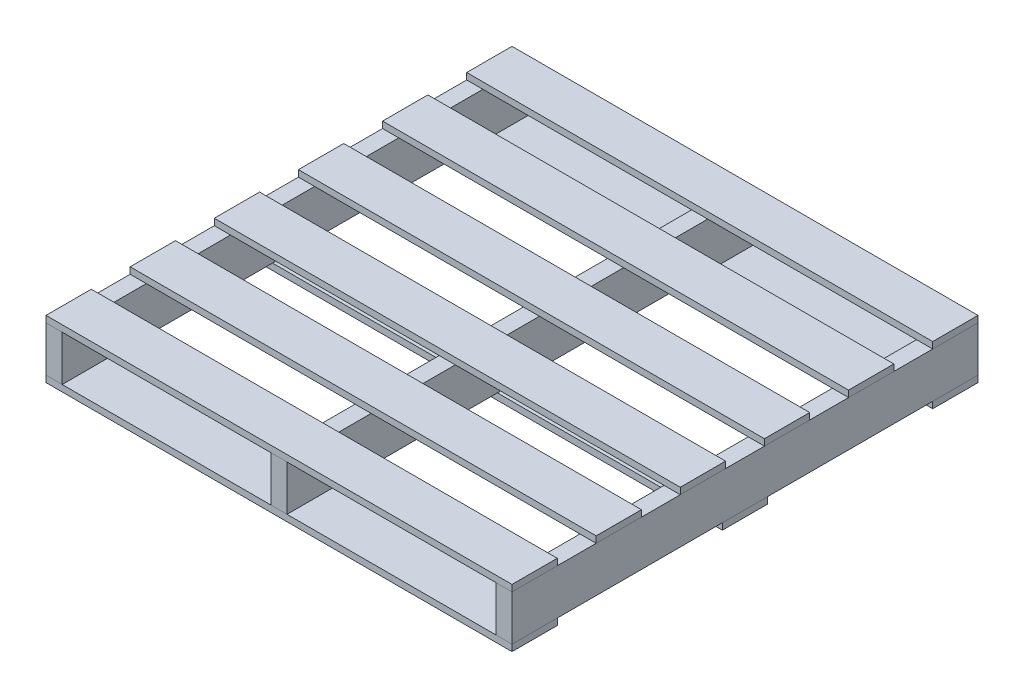
from build123d import *

# Parameters (mm, degrees)
BOSS_EXTRUDE1_DEPTH        = 457.2
BOSS_EXTRUDE1_DEPTH_BACK   = 457.2
SKETCH3_W                  = 31.75
SKETCH3_H                  = 88.9
BOSS_EXTRUDE1_2_DEPTH      = 457.2
BOSS_EXTRUDE1_2_DEPTH_BACK = 457.2
SKETCH3_W_2                = 31.496
BOSS_EXTRUDE1_3_DEPTH      = 457.2
BOSS_EXTRUDE1_3_DEPTH_BACK = 457.2
SKETCH4_W                  = 914.4
SKETCH4_H                  = 88.9
BOSS_EXTRUDE2_DEPTH        = 12.7
BOSS_EXTRUDE2_2_DEPTH      = 12.7
BOSS_EXTRUDE2_3_DEPTH      = 12.7
BOSS_EXTRUDE2_4_DEPTH      = 12.7
BOSS_EXTRUDE2_5_DEPTH      = 12.7
BOSS_EXTRUDE2_6_DEPTH      = 12.7
SKETCH5_W                  = 914.4
SKETCH5_H                  = 88.9
BOSS_EXTRUDE3_DEPTH        = 12.7
BOSS_EXTRUDE3_2_DEPTH      = 12.7
BOSS_EXTRUDE3_3_DEPTH      = 12.7


with BuildPart() as part:
    # Sketch3 → Boss-Extrude1 (new, two sides: drawn at the far end of the back side and taken through both)
    with BuildSketch(Plane.XY.offset(-BOSS_EXTRUDE1_DEPTH_BACK)):
        with Locations((-441.325, 0)):
            Rectangle(SKETCH3_W, SKETCH3_H)
    extrude(amount=BOSS_EXTRUDE1_DEPTH + BOSS_EXTRUDE1_DEPTH_BACK)


with BuildPart() as body_2:
    # Sketch3 → Boss-Extrude1 2 (new, two sides: drawn at the far end of the back side and taken through both)
    with BuildSketch(Plane.XY.offset(-BOSS_EXTRUDE1_2_DEPTH_BACK)):
        Rectangle(SKETCH3_W_2, SKETCH3_H)
    extrude(amount=BOSS_EXTRUDE1_2_DEPTH + BOSS_EXTRUDE1_2_DEPTH_BACK)


with BuildPart() as body_3:
    # Sketch3 → Boss-Extrude1 3 (new, two sides: drawn at the far end of the back side and taken through both)
    with BuildSketch(Plane.XY.offset(-BOSS_EXTRUDE1_3_DEPTH_BACK)):
        with Locations((441.325, 0)):
            Rectangle(SKETCH3_W, SKETCH3_H)
    extrude(amount=BOSS_EXTRUDE1_3_DEPTH + BOSS_EXTRUDE1_3_DEPTH_BACK)


with BuildPart() as body_4:
    # Sketch4 → Boss-Extrude2 (new body)
    with BuildSketch(Plane(origin=(0, 44.45, 0), x_dir=(1, 0, 0), z_dir=(0, 1, 0))):
        with Locations((0, -412.75)):
            Rectangle(SKETCH4_W, SKETCH4_H)
    extrude(amount=BOSS_EXTRUDE2_DEPTH)


with BuildPart() as body_5:
    # Sketch4 → Boss-Extrude2 2 (new body)
    with BuildSketch(Plane(origin=(0, 44.45, 0), x_dir=(1, 0, 0), z_dir=(0, 1, 0))):
        with Locations((0, -247.65)):
            Rectangle(SKETCH4_W, SKETCH4_H)
    extrude(amount=BOSS_EXTRUDE2_2_DEPTH)


with BuildPart() as body_6:
    # Sketch4 → Boss-Extrude2 3 (new body)
    with BuildSketch(Plane(origin=(0, 44.45, 0), x_dir=(1, 0, 0), z_dir=(0, 1, 0))):
        with Locations((0, -82.55)):
            Rectangle(SKETCH4_W, SKETCH4_H)
    extrude(amount=BOSS_EXTRUDE2_3_DEPTH)


with BuildPart() as body_7:
    # Sketch4 → Boss-Extrude2 4 (new body)
    with BuildSketch(Plane(origin=(0, 44.45, 0), x_dir=(1, 0, 0), z_dir=(0, 1, 0))):
        with Locations((0, 82.55)):
            Rectangle(SKETCH4_W, SKETCH4_H)
    extrude(amount=BOSS_EXTRUDE2_4_DEPTH)


with BuildPart() as body_8:
    # Sketch4 → Boss-Extrude2 5 (new body)
    with BuildSketch(Plane(origin=(0, 44.45, 0), x_dir=(1, 0, 0), z_dir=(0, 1, 0))):
        with Locations((0, 247.65)):
            Rectangle(SKETCH4_W, SKETCH4_H)
    extrude(amount=BOSS_EXTRUDE2_5_DEPTH)


with BuildPart() as body_9:
    # Sketch4 → Boss-Extrude2 6 (new body)
    with BuildSketch(Plane(origin=(0, 44.45, 0), x_dir=(1, 0, 0), z_dir=(0, 1, 0))):
        with Locations((0, 412.75)):
            Rectangle(SKETCH4_W, SKETCH4_H)
    extrude(amount=BOSS_EXTRUDE2_6_DEPTH)


with BuildPart() as body_10:
    # Sketch5 → Boss-Extrude3 (new body)
    with BuildSketch(Plane.XZ.offset(44.45)):
        with Locations((0, 412.75)):
            Rectangle(SKETCH5_W, SKETCH5_H)
    extrude(amount=BOSS_EXTRUDE3_DEPTH)


with BuildPart() as body_11:
    # Sketch5 → Boss-Extrude3 2 (new body)
    with BuildSketch(Plane.XZ.offset(44.45)):
        with Locations((0, -412.75)):
            Rectangle(SKETCH5_W, SKETCH5_H)
    extrude(amount=BOSS_EXTRUDE3_2_DEPTH)


with BuildPart() as body_12:
    # Sketch5 → Boss-Extrude3 3 (new body)
    with BuildSketch(Plane.XZ.offset(44.45)):
        Rectangle(SKETCH5_W, SKETCH5_H)
    extrude(amount=BOSS_EXTRUDE3_3_DEPTH)


solid = Compound([part.part, body_2.part, body_3.part, body_4.part, body_5.part, body_6.part, body_7.part, body_8.part, body_9.part, body_10.part, body_11.part, body_12.part])
